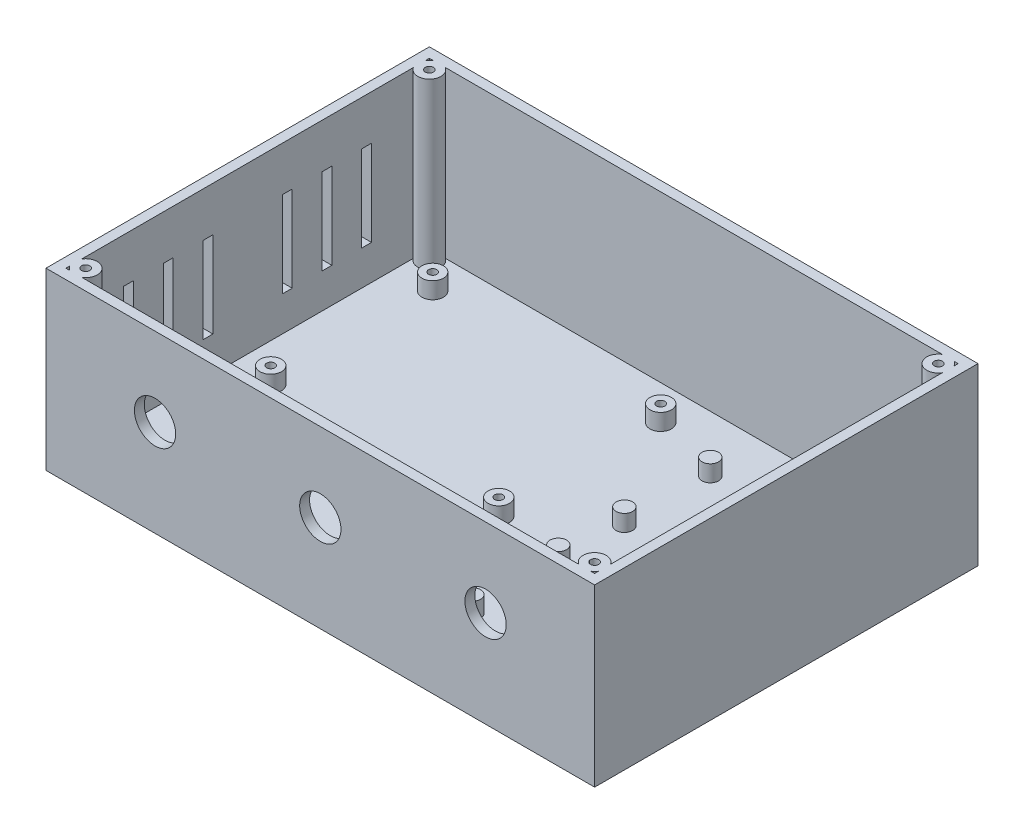
from build123d import *

# Parameters (mm, degrees)
SKETCH1_W               = 166
SKETCH1_H               = 116
BOX_SOLID_DEPTH         = 53
BOX_CAVITY_START        = 3
SKETCH2_W               = 160
SKETCH2_H               = 110
BOX_CAVITY_DEPTH        = 53
LID_SCREW_COLUMNS_START = 3
SKETCH3_R               = 3.5
LID_SCREW_COLUMNS_DEPTH = 50
LID_SCREW_HOLES_START   = 53
SKETCH4_R               = 1.25
LID_SCREW_HOLES_DEPTH   = 10
RELAY_BOSSES_START      = 3
SKETCH5_R               = 3.25
RELAY_BOSSES_DEPTH      = 5
RELAY_BOSS_HOLES_START  = 8
SKETCH6_R               = 1.25
RELAY_BOSS_HOLES_DEPTH  = 5
BOARD_PADS_START        = 3
SKETCH7_R               = 2.5
BOARD_PADS_DEPTH        = 5
CABLE_GLAND_HOLES_START = 54
SKETCH8_R               = 6.25
CABLE_GLAND_HOLES_DEPTH = 5
VENT_SLOTS_START        = -84
SKETCH9_W               = 3
SKETCH9_H               = 26
VENT_SLOTS_DEPTH        = 5
SKETCH10_R              = 5
LEG_SOCKETS_DEPTH       = 2


with BuildPart() as part:
    # Sketch1 → Box_Solid (new body)
    with BuildSketch(Plane(origin=(0, 0, 0), x_dir=(1, 0, 0), z_dir=(0, 1, 0))):
        Rectangle(SKETCH1_W, SKETCH1_H)
    extrude(amount=BOX_SOLID_DEPTH)

    # Sketch2 → Box_Cavity (cut)
    with BuildSketch(Plane(origin=(0, 0, 0), x_dir=(1, 0, 0), z_dir=(0, 1, 0)).offset(BOX_CAVITY_START)):
        Rectangle(SKETCH2_W, SKETCH2_H)
    extrude(amount=BOX_CAVITY_DEPTH, mode=Mode.SUBTRACT)

    # Sketch3 → Lid_Screw_Columns (add)
    with BuildSketch(Plane(origin=(0, 0, 0), x_dir=(1, 0, 0), z_dir=(0, 1, 0)).offset(LID_SCREW_COLUMNS_START)):
        with Locations((-77, 52)):
            Circle(SKETCH3_R)
        with Locations((-77, -52)):
            Circle(SKETCH3_R)
        with Locations((77, 52)):
            Circle(SKETCH3_R)
        with Locations((77, -52)):
            Circle(SKETCH3_R)
    extrude(amount=LID_SCREW_COLUMNS_DEPTH)

    # Sketch4 → Lid_Screw_Holes (cut)
    with BuildSketch(Plane(origin=(0, 0, 0), x_dir=(1, 0, 0), z_dir=(0, 1, 0)).offset(LID_SCREW_HOLES_START)):
        with Locations(Location((-77, 52, 0), (0, 0, 270))):
            Circle(SKETCH4_R)
        with Locations(Location((-77, -52, 0), (0, 0, 270))):
            Circle(SKETCH4_R)
        with Locations(Location((77, 52, 0), (0, 0, 270))):
            Circle(SKETCH4_R)
        with Locations(Location((77, -52, 0), (0, 0, 270))):
            Circle(SKETCH4_R)
    extrude(amount=-LID_SCREW_HOLES_DEPTH, mode=Mode.SUBTRACT)

    # Sketch5 → Relay_Bosses (add)
    with BuildSketch(Plane(origin=(0, 0, 0), x_dir=(1, 0, 0), z_dir=(0, 1, 0)).offset(RELAY_BOSSES_START)):
        with Locations(Location((-68.5, 44.5, 0), (0, 0, 90))):
            Circle(SKETCH5_R)
        with Locations(Location((-68.5, -4.5, 0), (0, 0, 90))):
            Circle(SKETCH5_R)
        with Locations(Location((0.5, 44.5, 0), (0, 0, 90))):
            Circle(SKETCH5_R)
        with Locations(Location((0.5, -4.5, 0), (0, 0, 90))):
            Circle(SKETCH5_R)
    extrude(amount=RELAY_BOSSES_DEPTH)

    # Sketch6 → Relay_Boss_Holes (cut)
    with BuildSketch(Plane(origin=(0, 0, 0), x_dir=(1, 0, 0), z_dir=(0, 1, 0)).offset(RELAY_BOSS_HOLES_START)):
        with Locations(Location((-68.5, 44.5, 0), (0, 0, 270))):
            Circle(SKETCH6_R)
        with Locations(Location((-68.5, -4.5, 0), (0, 0, 270))):
            Circle(SKETCH6_R)
        with Locations(Location((0.5, 44.5, 0), (0, 0, 270))):
            Circle(SKETCH6_R)
        with Locations(Location((0.5, -4.5, 0), (0, 0, 270))):
            Circle(SKETCH6_R)
    extrude(amount=-RELAY_BOSS_HOLES_DEPTH, mode=Mode.SUBTRACT)

    # Sketch7 → Board_Pads (add)
    with BuildSketch(Plane(origin=(0, 0, 0), x_dir=(1, 0, 0), z_dir=(0, 1, 0)).offset(BOARD_PADS_START)):
        with Locations(Location((-70.5, -20, 0), (0, 0, 90))):
            Circle(SKETCH7_R)
        with Locations(Location((-70.5, -42, 0), (0, 0, 90))):
            Circle(SKETCH7_R)
        with Locations(Location((-21.5, -20, 0), (0, 0, 90))):
            Circle(SKETCH7_R)
        with Locations(Location((-21.5, -42, 0), (0, 0, 90))):
            Circle(SKETCH7_R)
        with Locations(Location((-12, -32, 0), (0, 0, 90))):
            Circle(SKETCH7_R)
        with Locations(Location((-12, -44, 0), (0, 0, 90))):
            Circle(SKETCH7_R)
        with Locations(Location((10, -32, 0), (0, 0, 90))):
            Circle(SKETCH7_R)
        with Locations(Location((10, -44, 0), (0, 0, 90))):
            Circle(SKETCH7_R)
        with Locations(Location((22, 38, 0), (0, 0, 90))):
            Circle(SKETCH7_R)
        with Locations(Location((22, 12, 0), (0, 0, 90))):
            Circle(SKETCH7_R)
        with Locations(Location((58, 38, 0), (0, 0, 90))):
            Circle(SKETCH7_R)
        with Locations(Location((58, 12, 0), (0, 0, 90))):
            Circle(SKETCH7_R)
        with Locations(Location((22, -8, 0), (0, 0, 90))):
            Circle(SKETCH7_R)
        with Locations(Location((22, -34, 0), (0, 0, 90))):
            Circle(SKETCH7_R)
        with Locations(Location((58, -8, 0), (0, 0, 90))):
            Circle(SKETCH7_R)
        with Locations(Location((58, -34, 0), (0, 0, 90))):
            Circle(SKETCH7_R)
    extrude(amount=BOARD_PADS_DEPTH)

    # Sketch8 → Cable_Gland_Holes (cut)
    with BuildSketch(Plane.XY.offset(CABLE_GLAND_HOLES_START)):
        with Locations(Location((-50, 29.15, 0), (0, 0, 180))):
            Circle(SKETCH8_R)
        with Locations(Location((0, 29.15, 0), (0, 0, 180))):
            Circle(SKETCH8_R)
        with Locations(Location((50, 29.15, 0), (0, 0, 180))):
            Circle(SKETCH8_R)
    extrude(amount=CABLE_GLAND_HOLES_DEPTH, mode=Mode.SUBTRACT)

    # Sketch9 → Vent_Slots (cut)
    with BuildSketch(Plane(origin=(0, 0, 0), x_dir=(0, 0, -1), z_dir=(1, 0, 0)).offset(VENT_SLOTS_START)):
        with Locations((36, 26.5)):
            Rectangle(SKETCH9_W, SKETCH9_H)
        with Locations((24, 26.5)):
            Rectangle(SKETCH9_W, SKETCH9_H)
        with Locations((12, 26.5)):
            Rectangle(SKETCH9_W, SKETCH9_H)
        with Locations((-12, 26.5)):
            Rectangle(SKETCH9_W, SKETCH9_H)
        with Locations((-24, 26.5)):
            Rectangle(SKETCH9_W, SKETCH9_H)
        with Locations((-36, 26.5)):
            Rectangle(SKETCH9_W, SKETCH9_H)
    extrude(amount=VENT_SLOTS_DEPTH, mode=Mode.SUBTRACT)

    # Sketch10 → Leg_Sockets (cut)
    with BuildSketch(Plane(origin=(0, 0, 0), x_dir=(1, 0, 0), z_dir=(0, 1, 0))):
        with Locations(Location((-71, 46, 0), (0, 0, 270))):
            Circle(SKETCH10_R)
        with Locations(Location((-71, -46, 0), (0, 0, 270))):
            Circle(SKETCH10_R)
        with Locations(Location((71, 46, 0), (0, 0, 270))):
            Circle(SKETCH10_R)
        with Locations(Location((71, -46, 0), (0, 0, 270))):
            Circle(SKETCH10_R)
    extrude(amount=LEG_SOCKETS_DEPTH, mode=Mode.SUBTRACT)


solid = part.part
